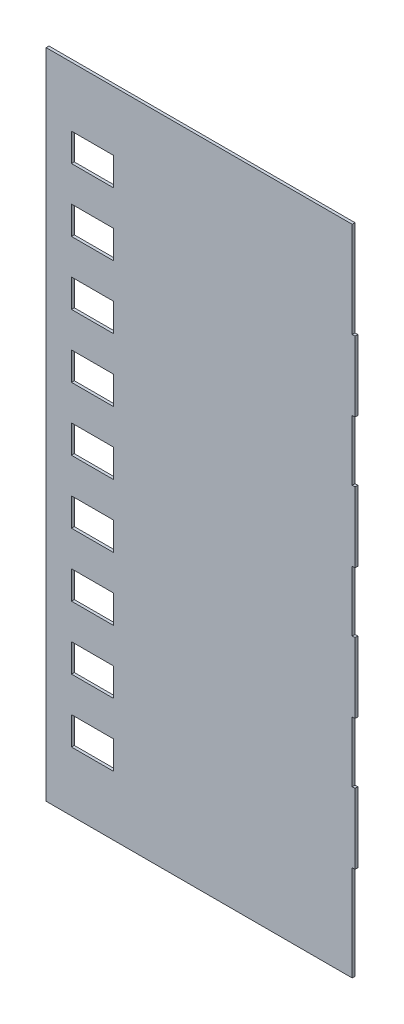
from build123d import *

# Parameters (mm, degrees)
SKETCH1_W           = 218
SKETCH1_H           = 465
BOSS_EXTRUDE1_DEPTH = 2
SKETCH2_W           = 30
SKETCH2_H           = 20
CUT_EXTRUDE1_DEPTH  = 8
BOSS_EXTRUDE2_DEPTH = 2


with BuildPart() as part:
    # Sketch1 → Boss-Extrude1 (new body)
    with BuildSketch(Plane.XY):
        Rectangle(SKETCH1_W, SKETCH1_H)
    extrude(amount=BOSS_EXTRUDE1_DEPTH)

    # Sketch2 → Cut-Extrude1 (cut)
    with BuildSketch(Plane.XY.offset(2)):
        Polygon((-61, 190), (-91, 190), (-91, 180), (-91, 170), (-61, 170), align=None)
        Polygon((-61, 145), (-91, 145), (-91, 135), (-91, 125), (-61, 125), align=None)
        with Locations((-76, 90)):
            Rectangle(SKETCH2_W, SKETCH2_H)
        with Locations((-76, 45)):
            Rectangle(SKETCH2_W, SKETCH2_H)
        with Locations((-76, 0)):
            Rectangle(SKETCH2_W, SKETCH2_H)
        with Locations((-76, -45)):
            Rectangle(SKETCH2_W, SKETCH2_H)
        with Locations((-76, -90)):
            Rectangle(SKETCH2_W, SKETCH2_H)
        with Locations((-76, -135)):
            Rectangle(SKETCH2_W, SKETCH2_H)
        with Locations((-76, -180)):
            Rectangle(SKETCH2_W, SKETCH2_H)
    extrude(amount=-CUT_EXTRUDE1_DEPTH, mode=Mode.SUBTRACT)

    # Sketch3 → Boss-Extrude2 (add)
    with BuildSketch(Plane.XY.offset(2)):
        Polygon((111, 164.5), (109, 164.5), (109, 139.5), (109, 114.5), (111, 114.5), align=None)
        Polygon((111, 71.5), (109, 71.5), (109, 46.5), (109, 21.5), (111, 21.5), align=None)
        Polygon((111, -114.5), (109, -114.5), (109, -139.5), (109, -164.5), (111, -164.5), align=None)
        Polygon((111, -21.5), (109, -21.5), (109, -46.5), (109, -71.5), (111, -71.5), align=None)
    extrude(amount=-BOSS_EXTRUDE2_DEPTH)


solid = part.part
